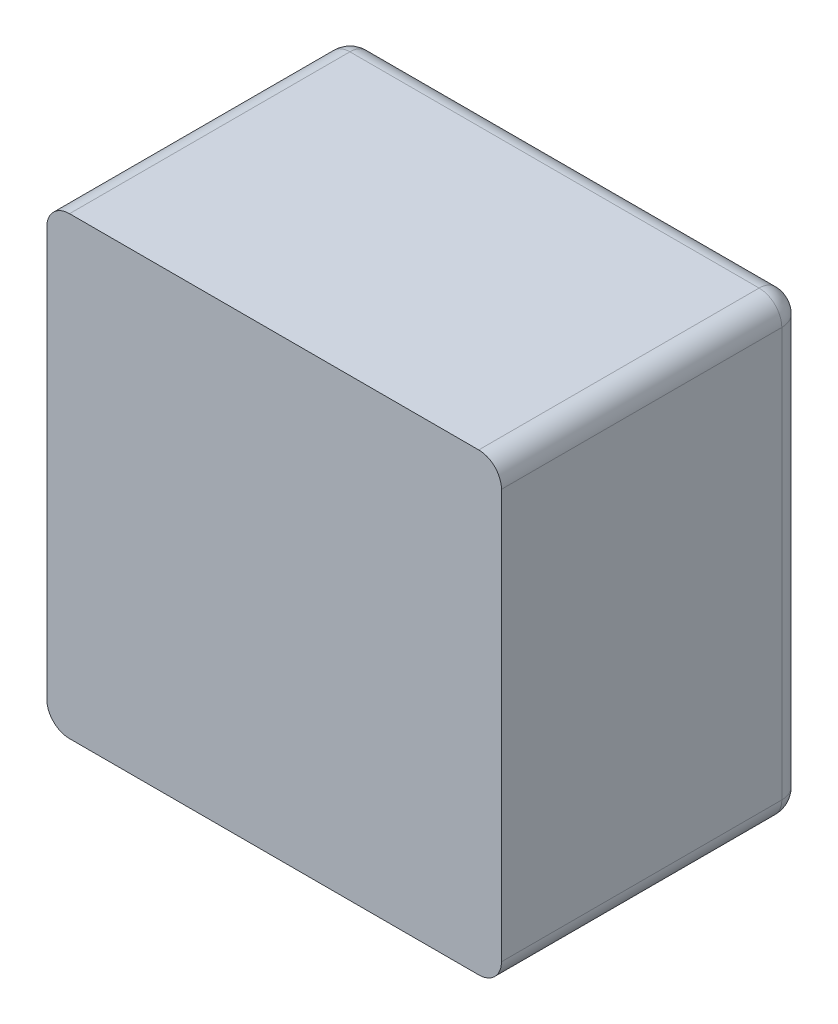
from build123d import *

# Parameters (mm, degrees)
SKETCH1_W           = 60
SKETCH1_H           = 60
BOSS_EXTRUDE1_DEPTH = 40
FILLET1_R           = 3
FILLET2_R           = 3
SKETCH2_R           = 20
CUT_EXTRUDE1_DEPTH  = 1


with BuildPart() as part:
    # Sketch1 → Boss-Extrude1 (new body)
    with BuildSketch(Plane.XY):
        with Locations((5, -3.4375)):
            Rectangle(SKETCH1_W, SKETCH1_H)
    extrude(amount=BOSS_EXTRUDE1_DEPTH)

    # Fillet1
    fillet1_edges = [part.edges().sort_by_distance(p)[0] for p in [
        (-25, 26.5625, 20),
        (35, 26.5625, 20),
        (35, -33.4375, 20),
        (-25, -33.4375, 20),
    ]]
    fillet(fillet1_edges, radius=FILLET1_R)

    # Fillet2
    fillet2_edges = [part.edges().sort_by_distance(p)[0] for p in [
        (35, -3.4375, 0),
        (-25, -3.4375, 0),
        (5, 26.5625, 0),
        (5, -33.4375, 0),
        (34.121320344, 25.683820344, 0),
        (-24.121320344, 25.683820344, 0),
        (-24.121320344, -32.558820344, 0),
        (34.121320344, -32.558820344, 0),
    ]]
    fillet(fillet2_edges, radius=FILLET2_R)

    # Sketch2 → Cut-Extrude1 (cut)
    with BuildSketch(Plane(origin=(0, 0, 0), x_dir=(-1, 0, 0), z_dir=(0, 0, -1))):
        with Locations((-5, -3.4375)):
            Circle(SKETCH2_R)
    extrude(amount=-CUT_EXTRUDE1_DEPTH, mode=Mode.SUBTRACT)


solid = part.part
